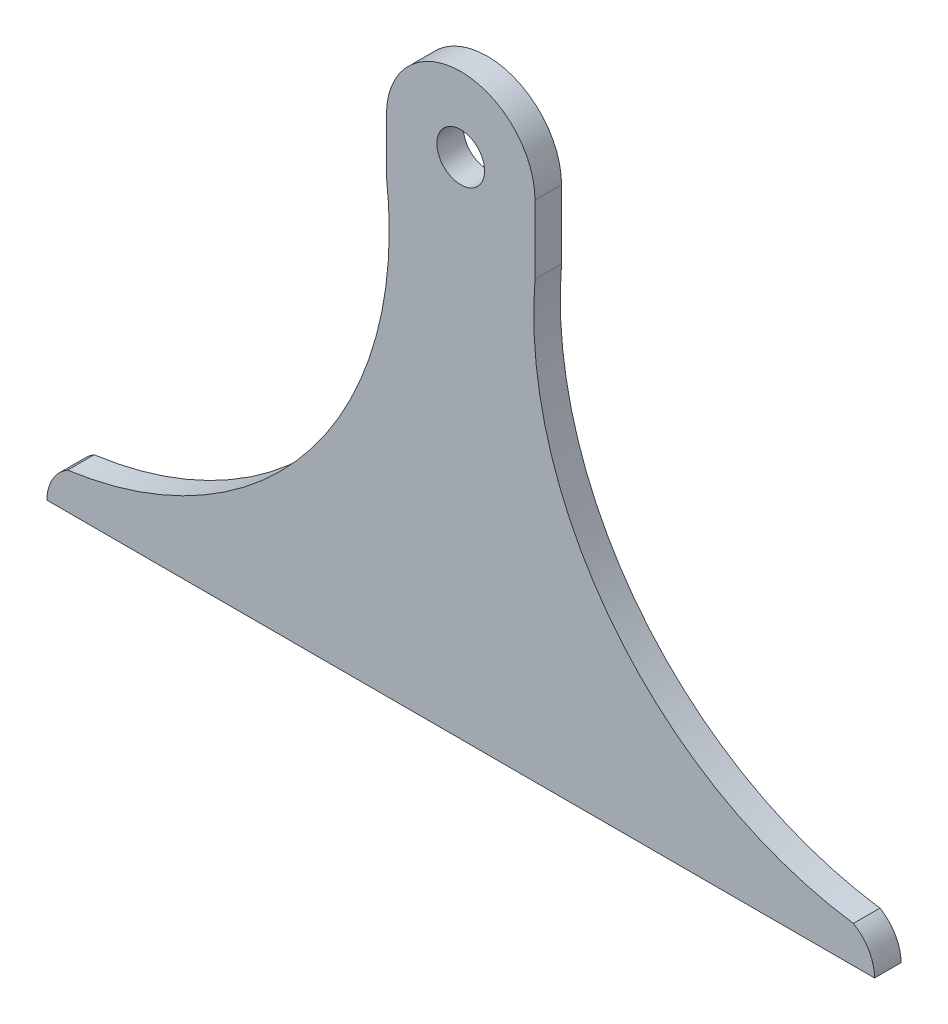
from build123d import *

# Parameters (mm, degrees)
SKETCH1_R           = 4.5
BOSS_EXTRUDE1_DEPTH = 5


with BuildPart() as part:
    # Sketch1 → Boss-Extrude1 (new body)
    # profile 1 of 3: a face of its own
    with BuildSketch(Plane.XY):
        with BuildLine():
            ThreePointArc((-13.638726053, -14), (-27.283749808, -60.504713891), (-67.865456294, -87))
            Line((-67.865456294, -87), (68.145154779, -87))
            ThreePointArc((68.145154779, -87), (27.563448293, -60.504713891), (13.918424538, -14))
            Line((13.918424538, -14), (-13.638726053, -14))
        make_face()
    # profile 2 of 3: a face of its own
    with BuildSketch(Plane.XY):
        with BuildLine():
            ThreePointArc((-74.103488032, -88.132585205), (-76.958013519, -91.052083097), (-78, -95))
            Line((-78, -95), (78, -95))
            ThreePointArc((78, -95), (76.93342531, -91.009058574), (74.018096633, -88.082276426))
            ThreePointArc((74.018096633, -88.082276426), (71.326143577, -87.650491647), (68.653046275, -87.114207988))
            ThreePointArc((68.653046275, -87.114207988), (68.398994359, -87.05757613), (68.145154779, -87))
            Line((68.145154779, -87), (-67.865456294, -87))
            ThreePointArc((-67.865456294, -87), (-68.182334922, -87.071720966), (-68.499543017, -87.141970423))
            ThreePointArc((-68.499543017, -87.141970423), (-71.291444545, -87.694249722), (-74.103488032, -88.132585205))
        make_face()
    # profile 3 of 3: a face of its own
    with BuildSketch(Plane.XY):
        with BuildLine():
            ThreePointArc((-14, -10.217990633), (-13.793699897, -12.106543863), (-13.638726053, -14))
            Line((-13.638726053, -14), (13.918424538, -14))
            ThreePointArc((13.918424538, -14), (13.95714549, -13.462707887), (14, -12.925729658))
            Line((14, -12.925729658), (14, 0))
            ThreePointArc((14, 0), (0, 14), (-14, 0))
            Line((-14, 0), (-14, -10.217990633))
        make_face()
        Circle(SKETCH1_R, mode=Mode.SUBTRACT)
    extrude(amount=BOSS_EXTRUDE1_DEPTH)


solid = part.part
